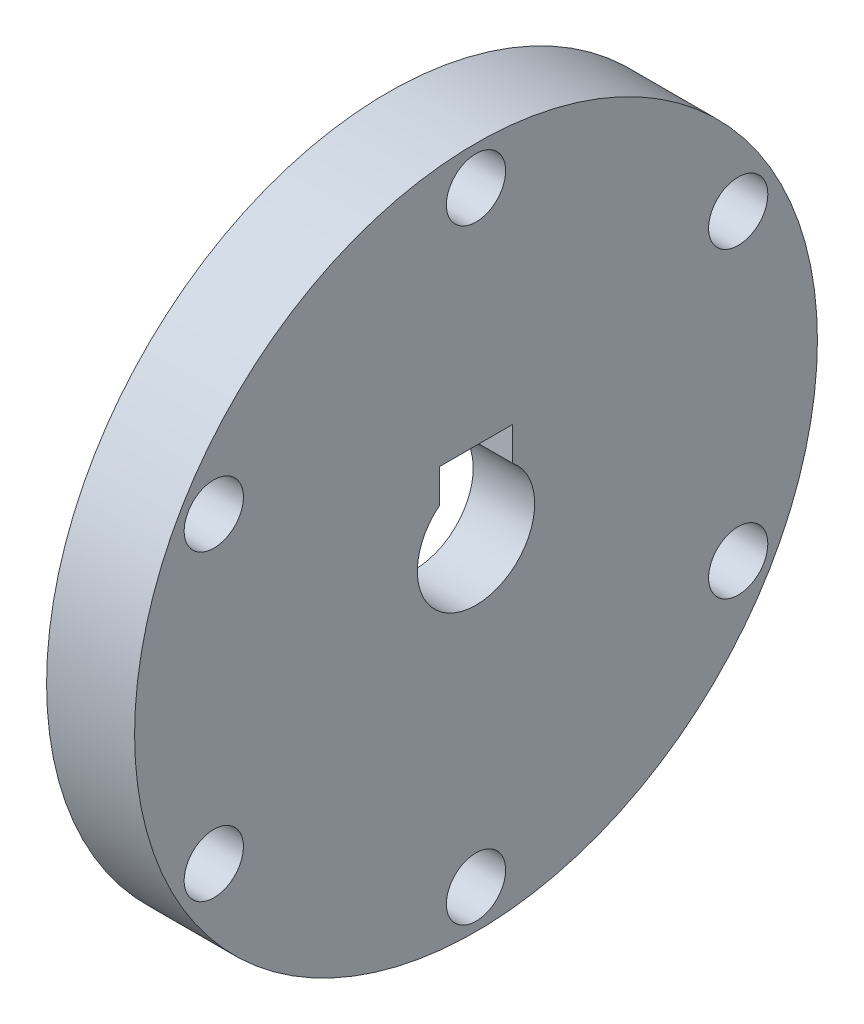
from build123d import *

# Parameters (mm, degrees)
SKETCH1_R           = 23.276074499
SKETCH1_R_2         = 2.0193
BOSS_EXTRUDE1_DEPTH = 6
SKETCH2_R           = 17.46
SKETCH2_R_2         = 15
BOSS_EXTRUDE2_DEPTH = 2
CUT_EXTRUDE2_START  = -1.8125
SKETCH4_R           = 15
CUT_EXTRUDE2_DEPTH  = 1.8125
CHAMFER4_SIZE       = 2.5
CHAMFER5_SIZE       = 1
CUT_EXTRUDE3_DEPTH  = 20.5


with BuildPart() as part:
    # Sketch1 → Boss-Extrude1 (new body)
    with BuildSketch(Plane(origin=(0, 0, 0), x_dir=(0, 0, -1), z_dir=(1, 0, 0))):
        Circle(SKETCH1_R)
        with Locations((0, 20.64)):
            Circle(SKETCH1_R_2, mode=Mode.SUBTRACT)
        with Locations((17.874764334, 10.32)):
            Circle(SKETCH1_R_2, mode=Mode.SUBTRACT)
        with Locations((17.874764334, -10.32)):
            Circle(SKETCH1_R_2, mode=Mode.SUBTRACT)
        with Locations((0, -20.64)):
            Circle(SKETCH1_R_2, mode=Mode.SUBTRACT)
        with Locations((-17.874764334, -10.32)):
            Circle(SKETCH1_R_2, mode=Mode.SUBTRACT)
        with Locations((-17.874764334, 10.32)):
            Circle(SKETCH1_R_2, mode=Mode.SUBTRACT)
    extrude(amount=BOSS_EXTRUDE1_DEPTH)

    # Sketch2 → Boss-Extrude2 (add)
    with BuildSketch(Plane.ZY):
        with Locations(Location((0, 0, 0), (0, 0, 180))):
            Circle(SKETCH2_R)
        Circle(SKETCH2_R_2, mode=Mode.SUBTRACT)
    extrude(amount=BOSS_EXTRUDE2_DEPTH)

    # Sketch4 → Cut-Extrude2 (cut)
    with BuildSketch(Plane.ZY.offset(CUT_EXTRUDE2_START)):
        Circle(SKETCH4_R)
    extrude(amount=CUT_EXTRUDE2_DEPTH, mode=Mode.SUBTRACT)

    # Chamfer4
    chamfer4_edges = [part.edges().sort_by_distance(p)[0] for p in [
        (1.8125, 0, -15),
    ]]
    chamfer(chamfer4_edges, length=CHAMFER4_SIZE)

    # Chamfer5
    chamfer5_edges = [part.edges().sort_by_distance(p)[0] for p in [
        (-2, 0, 17.46),
    ]]
    chamfer(chamfer5_edges, length=CHAMFER5_SIZE)

    # Sketch7 → Cut-Extrude3 (cut)
    with BuildSketch(Plane(origin=(6, 0, 0), x_dir=(0, 0, -1), z_dir=(1, 0, 0))):
        with BuildLine():
            Line((-2.5, 3.122498999), (-2.5, 5.422498999))
            Line((-2.5, 5.422498999), (2.5, 5.422498999))
            Line((2.5, 5.422498999), (2.5, 3.122498999))
            ThreePointArc((2.5, 3.122498999), (0, -4), (-2.5, 3.122498999))
        make_face()
    extrude(amount=-CUT_EXTRUDE3_DEPTH, mode=Mode.SUBTRACT)


solid = part.part
